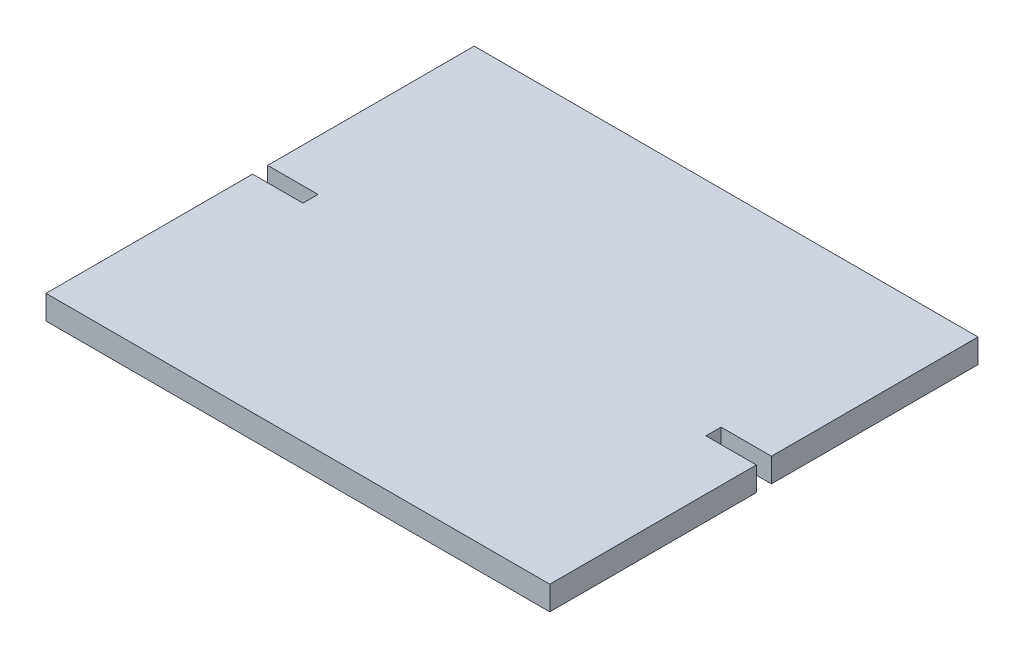
from build123d import *

# Parameters (mm, degrees)
BOSS_EXTRUDE1_DEPTH = 4.7625


with BuildPart() as part:
    # Sketch3 → Boss-Extrude1 (new body)
    with BuildSketch(Plane(origin=(0, 0, 0), x_dir=(1, 0, 0), z_dir=(0, 1, 0))):
        Polygon((-50, -42.5), (50, -42.5), (50, -1.5), (40, -1.5), (40, 1.5), (50, 1.5), (50, 42.5), (-50, 42.5), (-50, 1.5), (-40, 1.5), (-40, -1.5), (-50, -1.5), align=None)
    extrude(amount=-BOSS_EXTRUDE1_DEPTH)


solid = part.part
